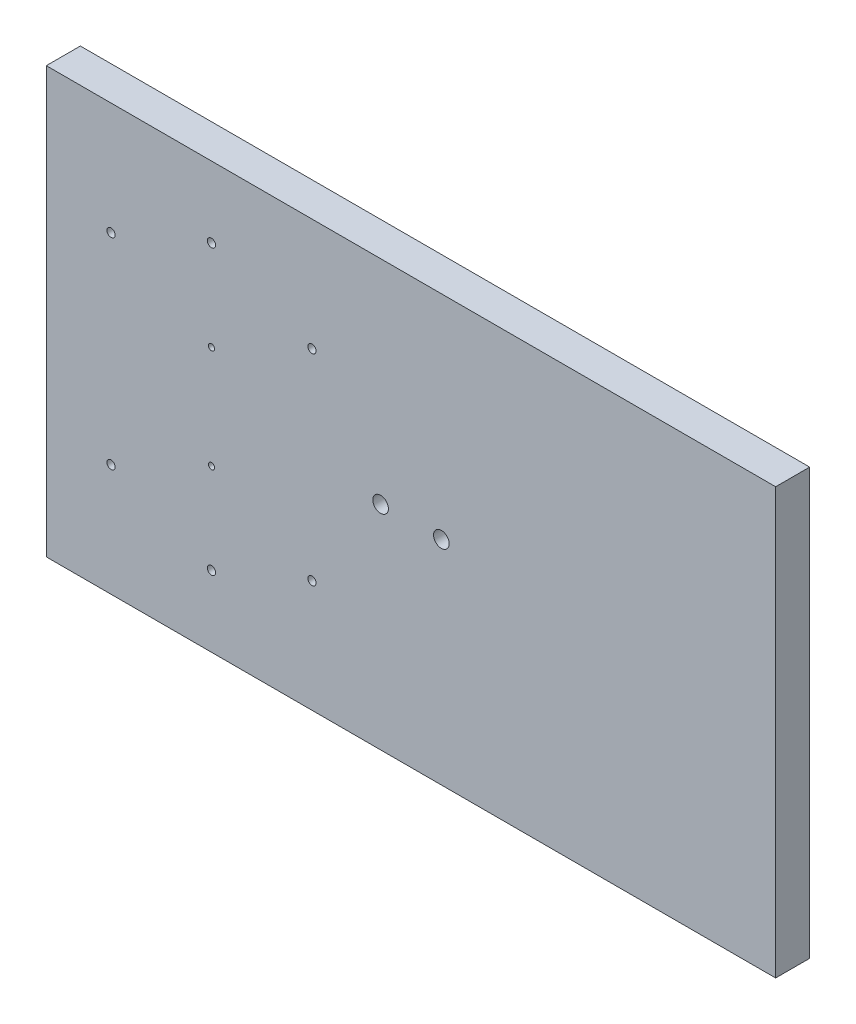
from build123d import *

# Parameters (mm, degrees)
SKETCH1_W                     = 304.8
SKETCH1_H                     = 177.8
BOSS_EXTRUDE1_DEPTH           = 14.224
TAP_DRILL_FOR_8_32_TAP1_D     = 3.4544
TAP_DRILL_FOR_8_32_TAP1_DEPTH = 7.874
TAP_DRILL_FOR_8_32_TAP1_TIP   = 1.037806461
TAP_DRILL_FOR_5_40_TAP1_D     = 2.5781
TAP_DRILL_FOR_5_40_TAP1_DEPTH = 7.874
TAP_DRILL_FOR_5_40_TAP1_TIP   = 0.774539381
F_1_4_CLEARANCE_HOLE1_D       = 6.5278


with BuildPart() as part:
    # Sketch1 → Boss-Extrude1 (new body)
    with BuildSketch(Plane.XY):
        Rectangle(SKETCH1_W, SKETCH1_H)
    extrude(amount=BOSS_EXTRUDE1_DEPTH)

    # Tap Drill for #8-32 Tap1
    with Locations(Plane.XY.offset(14.224)):
        with Locations((-41.39, 41.985), (-41.39, -41.985), (-125.36, -41.985), (-125.36, 41.985), (-83.375, 59.2455), (-83.375, -59.2455)):
            Hole(TAP_DRILL_FOR_8_32_TAP1_D / 2, depth=TAP_DRILL_FOR_8_32_TAP1_DEPTH)
            with Locations((0, 0, -(TAP_DRILL_FOR_8_32_TAP1_DEPTH + TAP_DRILL_FOR_8_32_TAP1_TIP / 2))):  # 118° drill point
                Cone(0, TAP_DRILL_FOR_8_32_TAP1_D / 2, TAP_DRILL_FOR_8_32_TAP1_TIP, mode=Mode.SUBTRACT)

    # Tap Drill for #5-40 Tap1
    with Locations(Plane.XY.offset(14.224)):
        with Locations((-83.375, 21.5), (-83.375, -21.5)):
            Hole(TAP_DRILL_FOR_5_40_TAP1_D / 2, depth=TAP_DRILL_FOR_5_40_TAP1_DEPTH)
            with Locations((0, 0, -(TAP_DRILL_FOR_5_40_TAP1_DEPTH + TAP_DRILL_FOR_5_40_TAP1_TIP / 2))):  # 118° drill point
                Cone(0, TAP_DRILL_FOR_5_40_TAP1_D / 2, TAP_DRILL_FOR_5_40_TAP1_TIP, mode=Mode.SUBTRACT)

    # 1/4 Clearance Hole1 (through all)
    with Locations(Plane(origin=(0, 0, 0), x_dir=(1, 0, 0), z_dir=(0, 0, -1))):
        with Locations((-12.7, 0), (12.7, 0)):
            Hole(F_1_4_CLEARANCE_HOLE1_D / 2)


solid = part.part
